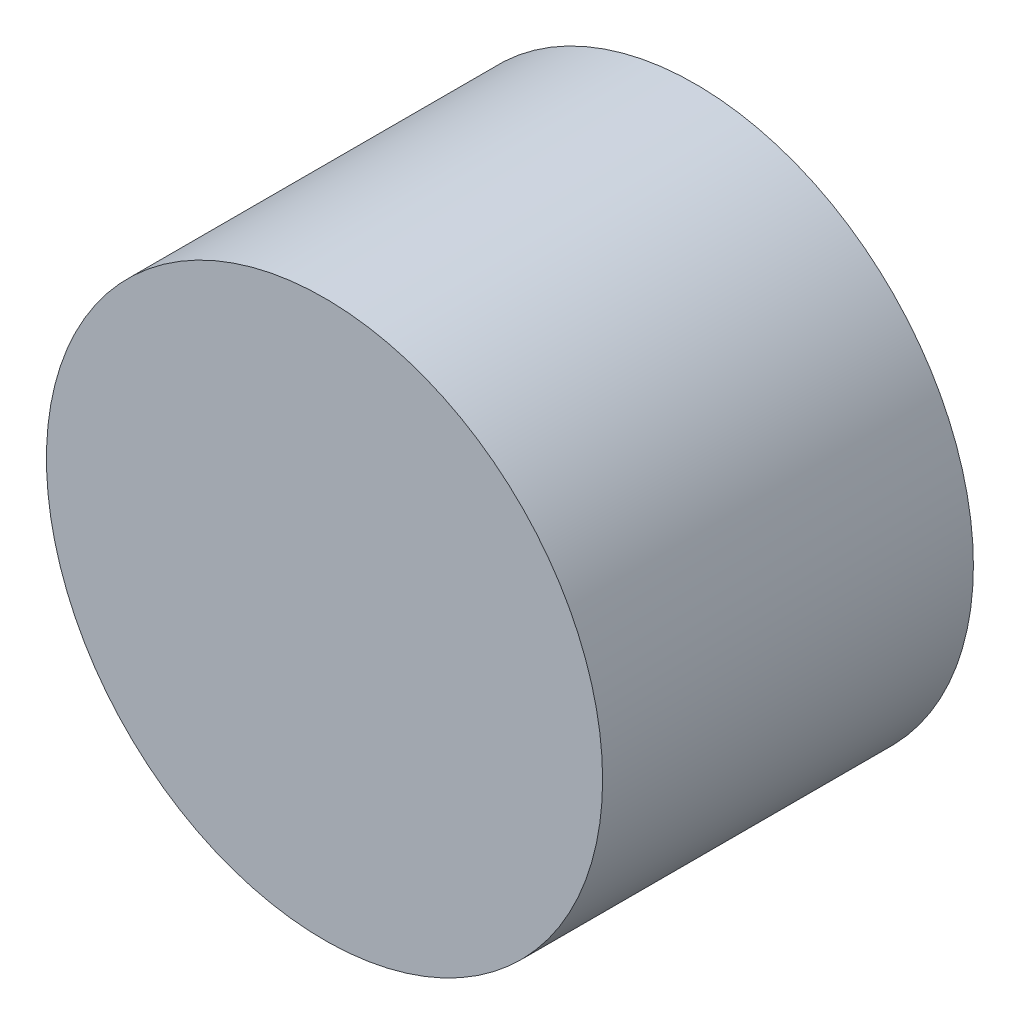
from build123d import *

# Parameters (mm, degrees)
ESQUISSE1_R        = 60
BOSS_EXTRU_1_DEPTH = 80


with BuildPart() as part:
    # Esquisse1 → Boss.-Extru.1 (new body)
    with BuildSketch(Plane.XY):
        Circle(ESQUISSE1_R)
    extrude(amount=BOSS_EXTRU_1_DEPTH)


solid = part.part
